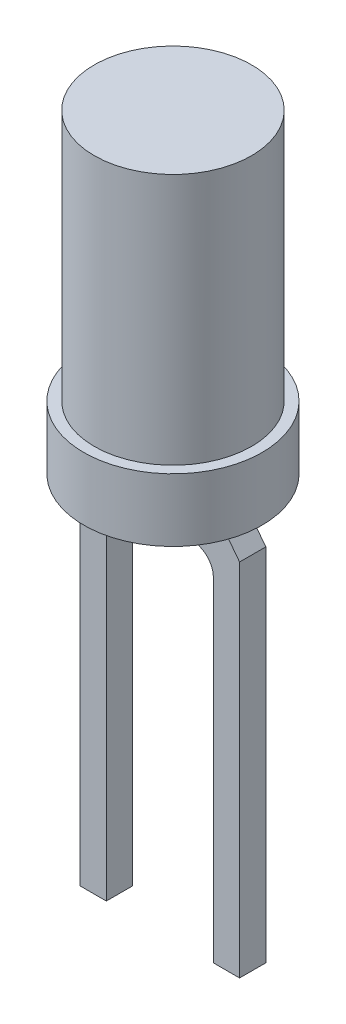
from build123d import *

# Parameters (mm, degrees)
ESQUISSE1_R             = 1.5
BOSS_EXTRU_1_DEPTH      = 4.8
ESQUISSE2_R             = 1.7
BOSS_EXTRU_2_DEPTH      = 1.2
BOSS_EXTRU_3_DEPTH      = 0.25
BOSS_EXTRU_3_DEPTH_BACK = 0.25


with BuildPart() as part:
    # Esquisse1 → Boss.-Extru.1 (new body)
    with BuildSketch(Plane(origin=(0, 0, 0), x_dir=(1, 0, 0), z_dir=(0, 1, 0))):
        Circle(ESQUISSE1_R)
    extrude(amount=-BOSS_EXTRU_1_DEPTH)

    # Esquisse2 → Boss.-Extru.2 (add)
    with BuildSketch(Plane.XZ.offset(4.8)):
        Circle(ESQUISSE2_R)
    extrude(amount=BOSS_EXTRU_2_DEPTH)

    # Esquisse3 → Boss.-Extru.3 (add, two sides: drawn at the far end of the back side and taken through both)
    with BuildSketch(Plane.XY.offset(-BOSS_EXTRU_3_DEPTH_BACK)):
        with BuildLine():
            Line((0.5, -6), (0.5, -6.672497838))
            Line((0.5, -6.672497838), (0.62, -6.672497838))
            ThreePointArc((0.62, -6.672497838), (0.902842712, -6.789655126), (1.02, -7.072497838))
            Line((1.02, -7.072497838), (1.02, -13.439637098))
            Line((1.02, -13.439637098), (1.52, -13.439637098))
            Line((1.52, -13.439637098), (1.52, -6.572497838))
            Line((1.52, -6.572497838), (1.084066682, -6))
            Line((1.084066682, -6), (0.5, -6))
        make_face()
        with BuildLine():
            Line((-1.084066682, -6), (-0.5, -6))
            Line((-0.5, -6), (-0.5, -6.672497838))
            Line((-0.5, -6.672497838), (-0.62, -6.672497838))
            ThreePointArc((-0.62, -6.672497838), (-0.902842712, -6.789655126), (-1.02, -7.072497838))
            Line((-1.02, -7.072497838), (-1.02, -13.439637098))
            Line((-1.02, -13.439637098), (-1.52, -13.439637098))
            Line((-1.52, -13.439637098), (-1.52, -6.572497838))
            Line((-1.52, -6.572497838), (-1.084066682, -6))
        make_face()
    extrude(amount=BOSS_EXTRU_3_DEPTH + BOSS_EXTRU_3_DEPTH_BACK)


solid = part.part
